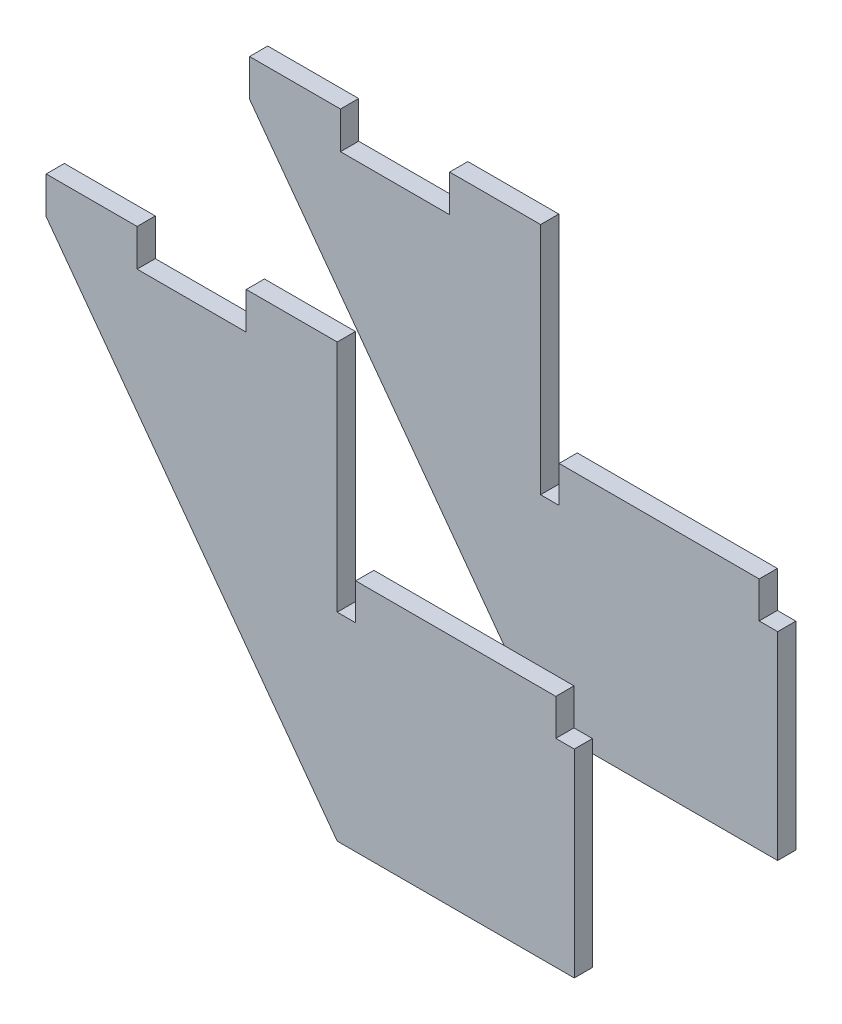
from build123d import *

# Parameters (mm, degrees)
BOSS_EXTRUDE1_START = 236.892664
BOSS_EXTRUDE1_DEPTH = 10
BOSS_EXTRUDE2_START = 125.085498
BOSS_EXTRUDE2_DEPTH = 10


with BuildPart() as part:
    # Sketch1 → Boss-Extrude1 (new body)
    with BuildSketch(Plane.XY.offset(BOSS_EXTRUDE1_START)):
        Polygon((-210.16, -2161.218921834), (-200, -2161.218921834), (-200, -2141.218921834), (-90, -2141.218921834), (-90, -2161.218921834), (-79.84, -2161.218921834), (-79.84, -2270.218921834), (-210.16, -2270.218921834), (-370.16, -2052.911580455), (-370.16, -2032.591580455), (-320.16, -2032.591580455), (-320.16, -2052.911580455), (-260.16, -2052.911580455), (-260.16, -2032.591580455), (-210.16, -2032.591580455), (-210.16, -2052.911580455), align=None)
    extrude(amount=BOSS_EXTRUDE1_DEPTH)


with BuildPart() as body_2:
    # Sketch1<2> → Boss-Extrude2 (new body)
    with BuildSketch(Plane.XY.offset(BOSS_EXTRUDE2_START)):
        Polygon((-210.16, -2161.218921834), (-200, -2161.218921834), (-200, -2141.218921834), (-90, -2141.218921834), (-90, -2161.218921834), (-79.84, -2161.218921834), (-79.84, -2270.218921834), (-210.16, -2270.218921834), (-370.16, -2052.911580455), (-370.16, -2032.591580455), (-320.16, -2032.591580455), (-320.16, -2052.911580455), (-260.16, -2052.911580455), (-260.16, -2032.591580455), (-210.16, -2032.591580455), (-210.16, -2052.911580455), align=None)
    extrude(amount=BOSS_EXTRUDE2_DEPTH)


solid = Compound([part.part, body_2.part])
